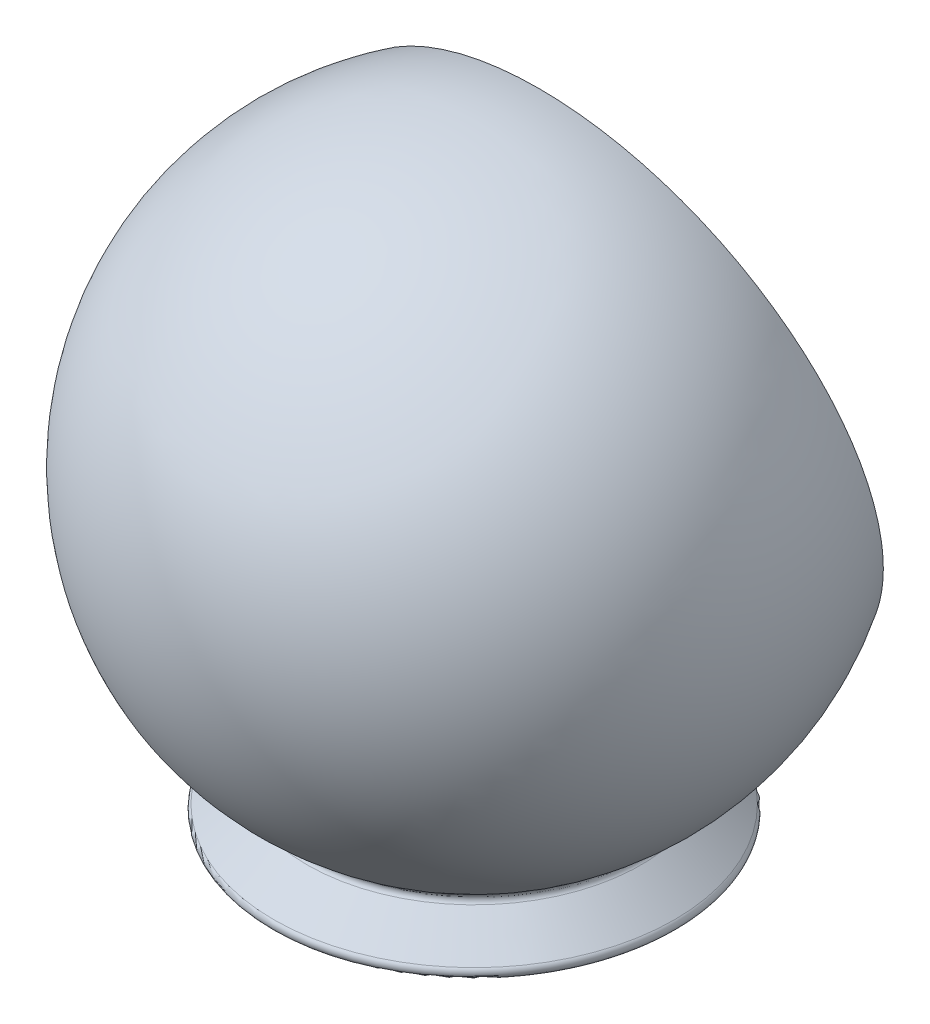
from build123d import *

# Parameters (mm, degrees)
SKETCH8_R          = 27.942007566
SKETCH9_R          = 44.45
FILLET2_R          = 1.27
FILLET3_R          = 1.27
SKETCH12_R         = 57.37388449
CUT_EXTRUDE1_DEPTH = 38.1


with BuildPart() as part:
    # Base_sketch → Revolve2 (revolve)
    with BuildSketch(Plane(origin=(0, 0, 0), x_dir=(1, 0, 0), z_dir=(0, 1, 0))):
        with BuildLine():
            Line((0, 63.5), (0, -63.5))
            ThreePointArc((0, -63.5), (63.5, 0), (0, 63.5))
        make_face()
    revolve(axis=Axis((0, 0, -63.5), (0, 0, 1)))


with BuildPart() as body_2:
    # Sketch8 → Loft1 section 0
    with BuildSketch(Plane(origin=(0, -48.26, 0), x_dir=(1, 0, 0), z_dir=(0, 1, 0))):
        Circle(SKETCH8_R)
    # Sketch9 → Loft1 section 1
    with BuildSketch(Plane(origin=(0, -63.5, 0), x_dir=(1, 0, 0), z_dir=(0, 1, 0))):
        Circle(SKETCH9_R)
    loft()

    # Combine1: union part
    add(part.part)

    # Fillet2
    fillet2_edges = [body_2.edges().sort_by_distance(p)[0] for p in [
        (-33.857266982, -53.720903494, -1.69e-07),
    ]]
    fillet(fillet2_edges, radius=FILLET2_R)

    # Fillet3
    fillet3_edges = [body_2.edges().sort_by_distance(p)[0] for p in [
        (-44.45, -63.5, 0),
    ]]
    fillet(fillet3_edges, radius=FILLET3_R)

    # Sketch12 → Cut-Extrude1 (cut)
    with BuildSketch(Plane(origin=(0, 6.835797067, -27.41688454), x_dir=(-1, 0, 0), z_dir=(0, 0.2419218955996649, -0.9702957262759973))):
        Circle(SKETCH12_R)
    extrude(amount=CUT_EXTRUDE1_DEPTH, mode=Mode.SUBTRACT)


solid = body_2.part
